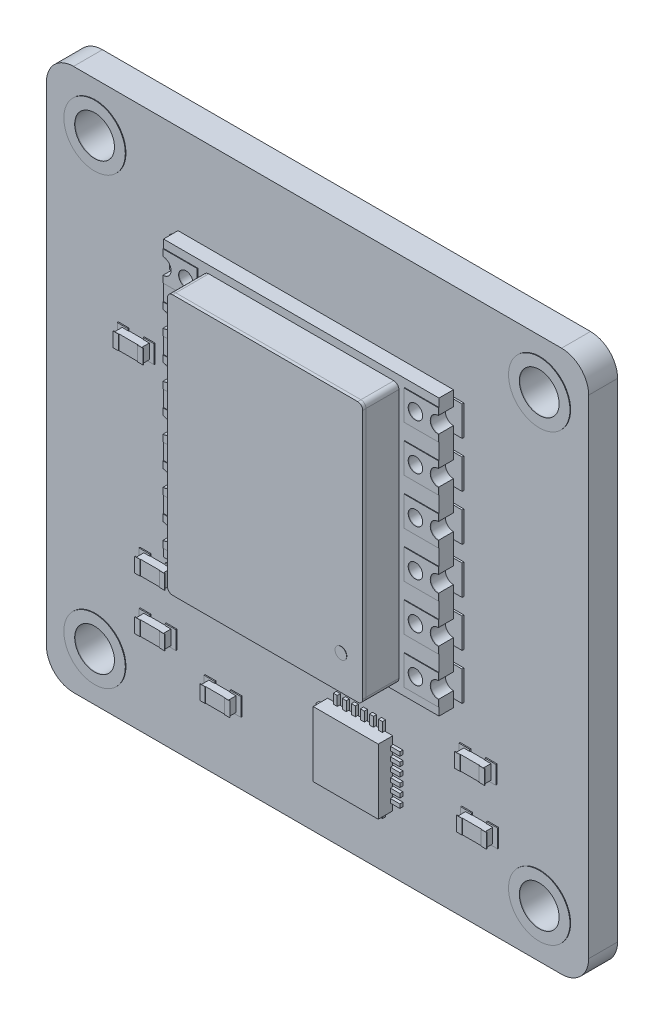
from build123d import *

# Parameters (mm, degrees)
PCB_30X30X1_6_D2_2_24_6_2_R              = 1.1
PCB_30X30X1_6_D2_2_24_6_DEPTH            = 1.6
EXTRUDE_START                            = 1.6
SKETCH_395_R                             = 1.7
SKETCH_395_R_2                           = 1.1
EXTRUDE_419_DEPTH                        = 0.035
EXTRUDE_419_2_DEPTH                      = 0.035
EXTRUDE_419_3_DEPTH                      = 0.035
EXTRUDE_419_4_DEPTH                      = 0.035
SKETCH_12_2_54_W                         = 2.5
SKETCH_12_2_54_H                         = 1.65
EXTRUDE_12_2_54_DEPTH                    = 0.1
EXTRUDE_12_2_54_2_DEPTH                  = 0.1
EXTRUDE_12_2_54_3_DEPTH                  = 0.1
EXTRUDE_12_2_54_4_DEPTH                  = 0.1
EXTRUDE_12_2_54_5_DEPTH                  = 0.1
EXTRUDE_12_2_54_6_DEPTH                  = 0.1
EXTRUDE_12_2_54_7_DEPTH                  = 0.1
EXTRUDE_12_2_54_8_DEPTH                  = 0.1
EXTRUDE_12_2_54_9_DEPTH                  = 0.1
EXTRUDE_12_2_54_10_DEPTH                 = 0.1
EXTRUDE_12_2_54_11_DEPTH                 = 0.1
EXTRUDE_12_2_54_12_DEPTH                 = 0.1
PCB_15_24X15_24X0_8_START                = 1.7
PCB_15_24X15_24X0_8_DEPTH                = 0.8
EXTRUDE_START_2                          = 2.5
EXTRUDE_12_DEPTH                         = 0.035
EXTRUDE_12_2_DEPTH                       = 0.035
EXTRUDE_12_3_DEPTH                       = 0.035
EXTRUDE_12_4_DEPTH                       = 0.035
EXTRUDE_12_5_DEPTH                       = 0.035
EXTRUDE_12_6_DEPTH                       = 0.035
EXTRUDE_12_7_DEPTH                       = 0.035
EXTRUDE_12_8_DEPTH                       = 0.035
EXTRUDE_12_9_DEPTH                       = 0.035
EXTRUDE_12_10_DEPTH                      = 0.035
EXTRUDE_12_11_DEPTH                      = 0.035
EXTRUDE_12_12_DEPTH                      = 0.035
EXTRUDE_0_18_DEPTH                       = 1.82
EXTRUDE_START_3                          = 4.32
EXTRUDE_0_18_2_8_DEPTH                   = 0.18
EXTRUDE_START_4                          = 4.5
SKETCH_1971_R                            = 0.32
EXTRUDE_1980_DEPTH                       = 0.012
EXTRUDE_START_5                          = 1.64
SKETCH_4X4_W                             = 3.6
SKETCH_4X4_H                             = 3.6
EXTRUDE_4X4_DEPTH                        = 0.8
SKETCH_24_W                              = 0.22
SKETCH_24_H                              = 0.55
EXTRUDE_24_DEPTH                         = 0.17
EXTRUDE_24_2_DEPTH                       = 0.17
SKETCH_24_W_2                            = 0.55
SKETCH_24_H_2                            = 0.22
EXTRUDE_24_3_DEPTH                       = 0.17
EXTRUDE_24_4_DEPTH                       = 0.17
EXTRUDE_24_5_DEPTH                       = 0.17
EXTRUDE_24_6_DEPTH                       = 0.17
EXTRUDE_24_7_DEPTH                       = 0.17
EXTRUDE_24_8_DEPTH                       = 0.17
EXTRUDE_24_9_DEPTH                       = 0.17
EXTRUDE_24_10_DEPTH                      = 0.17
EXTRUDE_24_11_DEPTH                      = 0.17
EXTRUDE_24_12_DEPTH                      = 0.17
EXTRUDE_24_13_DEPTH                      = 0.17
EXTRUDE_24_14_DEPTH                      = 0.17
EXTRUDE_24_15_DEPTH                      = 0.17
EXTRUDE_24_16_DEPTH                      = 0.17
EXTRUDE_24_17_DEPTH                      = 0.17
EXTRUDE_24_18_DEPTH                      = 0.17
EXTRUDE_24_19_DEPTH                      = 0.17
EXTRUDE_24_20_DEPTH                      = 0.17
EXTRUDE_24_21_DEPTH                      = 0.17
EXTRUDE_24_22_DEPTH                      = 0.17
EXTRUDE_24_23_DEPTH                      = 0.17
EXTRUDE_24_24_DEPTH                      = 0.17
SKETCH_3138_W                            = 0.6
SKETCH_3138_H                            = 1
EXTRUDE_3373_DEPTH                       = 0.06
EXTRUDE_3373_2_DEPTH                     = 0.06
EXTRUDE_3373_3_DEPTH                     = 0.06
EXTRUDE_3373_4_DEPTH                     = 0.06
EXTRUDE_3373_5_DEPTH                     = 0.06
EXTRUDE_3373_6_DEPTH                     = 0.06
EXTRUDE_3373_7_DEPTH                     = 0.06
EXTRUDE_3373_8_DEPTH                     = 0.06
EXTRUDE_3373_9_DEPTH                     = 0.06
EXTRUDE_3373_10_DEPTH                    = 0.06
EXTRUDE_3373_11_DEPTH                    = 0.06
EXTRUDE_3373_12_DEPTH                    = 0.06
SKETCH_1_W                               = 1.5
SKETCH_1_H                               = 0.8
EXTRUDE_1_DEPTH                          = 0.42
SKETCH_2_W                               = 1.5
SKETCH_2_H                               = 0.8
EXTRUDE_2_DEPTH                          = 0.42
SKETCH_3_W                               = 1.5
SKETCH_3_H                               = 0.8
EXTRUDE_3_DEPTH                          = 0.42
SKETCH_4_W                               = 1.5
SKETCH_4_H                               = 0.8
EXTRUDE_4_DEPTH                          = 0.42
SKETCH_5_W                               = 1.5
SKETCH_5_H                               = 0.8
EXTRUDE_5_DEPTH                          = 0.42
SKETCH_6_W                               = 1.5
SKETCH_6_H                               = 0.8
EXTRUDE_6_DEPTH                          = 0.42
EXTRUDE_START_6                          = 2.06
SKETCH_4104_W                            = 0.3
SKETCH_4104_H                            = 0.8
EXTRUDE_4339_DEPTH                       = 0.025
EXTRUDE_4339_2_DEPTH                     = 0.025
EXTRUDE_4339_3_DEPTH                     = 0.025
EXTRUDE_4339_4_DEPTH                     = 0.025
EXTRUDE_4339_5_DEPTH                     = 0.025
EXTRUDE_4339_6_DEPTH                     = 0.025
EXTRUDE_4339_7_DEPTH                     = 0.025
EXTRUDE_4339_8_DEPTH                     = 0.025
EXTRUDE_4339_9_DEPTH                     = 0.025
EXTRUDE_4339_10_DEPTH                    = 0.025
EXTRUDE_4339_11_DEPTH                    = 0.025
EXTRUDE_4339_12_DEPTH                    = 0.025
CUT_EXTRUDE_12_D0_8_12_7_2_54_DEPTH      = 22.687741791
CUT_EXTRUDE_12_D0_8_12_7_2_54_DEPTH_BACK = 22.687741791
F_12XD0_8_R                              = 0.4


with BuildPart() as part:
    # PCB_30x30x1.6__D2.2__24.6 2 → PCB_30x30x1.6__D2.2__24.6 (new body)
    with BuildSketch(Plane.XY):
        with BuildLine():
            Line((-13.5, -15), (13.5, -15))
            ThreePointArc((13.5, -15), (14.560660172, -14.560660172), (15, -13.5))
            Line((15, -13.5), (15, 13.5))
            ThreePointArc((15, 13.5), (14.560660172, 14.560660172), (13.5, 15))
            Line((13.5, 15), (-13.5, 15))
            ThreePointArc((-13.5, 15), (-14.560660172, 14.560660172), (-15, 13.5))
            Line((-15, 13.5), (-15, -13.5))
            ThreePointArc((-15, -13.5), (-14.560660172, -14.560660172), (-13.5, -15))
        make_face()
        with Locations((-12.3, -12.3)):
            Circle(PCB_30X30X1_6_D2_2_24_6_2_R, mode=Mode.SUBTRACT)
        with Locations((-12.3, 12.3)):
            Circle(PCB_30X30X1_6_D2_2_24_6_2_R, mode=Mode.SUBTRACT)
        with Locations((12.3, -12.3)):
            Circle(PCB_30X30X1_6_D2_2_24_6_2_R, mode=Mode.SUBTRACT)
        with Locations((12.3, 12.3)):
            Circle(PCB_30X30X1_6_D2_2_24_6_2_R, mode=Mode.SUBTRACT)
    extrude(amount=PCB_30X30X1_6_D2_2_24_6_DEPTH)


with BuildPart() as body_2:
    # Sketch 395 → Extrude 419 (new body)
    with BuildSketch(Plane.XY.offset(EXTRUDE_START)):
        with Locations((-12.3, -12.3)):
            Circle(SKETCH_395_R)
        with Locations((-12.3, -12.3)):
            Circle(SKETCH_395_R_2, mode=Mode.SUBTRACT)
    extrude(amount=EXTRUDE_419_DEPTH)


with BuildPart() as body_3:
    # Sketch 395 → Extrude 419 2 (new body)
    with BuildSketch(Plane.XY.offset(EXTRUDE_START)):
        with Locations((-12.3, 12.3)):
            Circle(SKETCH_395_R)
        with Locations((-12.3, 12.3)):
            Circle(SKETCH_395_R_2, mode=Mode.SUBTRACT)
    extrude(amount=EXTRUDE_419_2_DEPTH)


with BuildPart() as body_4:
    # Sketch 395 → Extrude 419 3 (new body)
    with BuildSketch(Plane.XY.offset(EXTRUDE_START)):
        with Locations((12.3, -12.3)):
            Circle(SKETCH_395_R)
        with Locations((12.3, -12.3)):
            Circle(SKETCH_395_R_2, mode=Mode.SUBTRACT)
    extrude(amount=EXTRUDE_419_3_DEPTH)


with BuildPart() as body_5:
    # Sketch 395 → Extrude 419 4 (new body)
    with BuildSketch(Plane.XY.offset(EXTRUDE_START)):
        with Locations((12.3, 12.3)):
            Circle(SKETCH_395_R)
        with Locations((12.3, 12.3)):
            Circle(SKETCH_395_R_2, mode=Mode.SUBTRACT)
    extrude(amount=EXTRUDE_419_4_DEPTH)


with BuildPart() as body_6:
    # 载板12处焊接焊盘_间距2.54_草图 → 载板12处焊接焊盘_间距2.54 (new body)
    with BuildSketch(Plane.XY.offset(EXTRUDE_START)):
        with Locations((-6.85, -3.85)):
            Rectangle(SKETCH_12_2_54_W, SKETCH_12_2_54_H)
    extrude(amount=EXTRUDE_12_2_54_DEPTH)


with BuildPart() as body_7:
    # 载板12处焊接焊盘_间距2.54_草图 → Extrude 12___2.54 2 (new body)
    with BuildSketch(Plane.XY.offset(EXTRUDE_START)):
        with Locations((-6.85, -1.31)):
            Rectangle(SKETCH_12_2_54_W, SKETCH_12_2_54_H)
    extrude(amount=EXTRUDE_12_2_54_2_DEPTH)


with BuildPart() as body_8:
    # 载板12处焊接焊盘_间距2.54_草图 → Extrude 12___2.54 3 (new body)
    with BuildSketch(Plane.XY.offset(EXTRUDE_START)):
        with Locations((-6.85, 1.23)):
            Rectangle(SKETCH_12_2_54_W, SKETCH_12_2_54_H)
    extrude(amount=EXTRUDE_12_2_54_3_DEPTH)


with BuildPart() as body_9:
    # 载板12处焊接焊盘_间距2.54_草图 → Extrude 12___2.54 4 (new body)
    with BuildSketch(Plane.XY.offset(EXTRUDE_START)):
        with Locations((-6.85, 3.77)):
            Rectangle(SKETCH_12_2_54_W, SKETCH_12_2_54_H)
    extrude(amount=EXTRUDE_12_2_54_4_DEPTH)


with BuildPart() as body_10:
    # 载板12处焊接焊盘_间距2.54_草图 → Extrude 12___2.54 5 (new body)
    with BuildSketch(Plane.XY.offset(EXTRUDE_START)):
        with Locations((-6.85, 6.31)):
            Rectangle(SKETCH_12_2_54_W, SKETCH_12_2_54_H)
    extrude(amount=EXTRUDE_12_2_54_5_DEPTH)


with BuildPart() as body_11:
    # 载板12处焊接焊盘_间距2.54_草图 → Extrude 12___2.54 6 (new body)
    with BuildSketch(Plane.XY.offset(EXTRUDE_START)):
        with Locations((-6.85, 8.85)):
            Rectangle(SKETCH_12_2_54_W, SKETCH_12_2_54_H)
    extrude(amount=EXTRUDE_12_2_54_6_DEPTH)


with BuildPart() as body_12:
    # 载板12处焊接焊盘_间距2.54_草图 → Extrude 12___2.54 7 (new body)
    with BuildSketch(Plane.XY.offset(EXTRUDE_START)):
        with Locations((6.85, -3.85)):
            Rectangle(SKETCH_12_2_54_W, SKETCH_12_2_54_H)
    extrude(amount=EXTRUDE_12_2_54_7_DEPTH)


with BuildPart() as body_13:
    # 载板12处焊接焊盘_间距2.54_草图 → Extrude 12___2.54 8 (new body)
    with BuildSketch(Plane.XY.offset(EXTRUDE_START)):
        with Locations((6.85, -1.31)):
            Rectangle(SKETCH_12_2_54_W, SKETCH_12_2_54_H)
    extrude(amount=EXTRUDE_12_2_54_8_DEPTH)


with BuildPart() as body_14:
    # 载板12处焊接焊盘_间距2.54_草图 → Extrude 12___2.54 9 (new body)
    with BuildSketch(Plane.XY.offset(EXTRUDE_START)):
        with Locations((6.85, 1.23)):
            Rectangle(SKETCH_12_2_54_W, SKETCH_12_2_54_H)
    extrude(amount=EXTRUDE_12_2_54_9_DEPTH)


with BuildPart() as body_15:
    # 载板12处焊接焊盘_间距2.54_草图 → Extrude 12___2.54 10 (new body)
    with BuildSketch(Plane.XY.offset(EXTRUDE_START)):
        with Locations((6.85, 3.77)):
            Rectangle(SKETCH_12_2_54_W, SKETCH_12_2_54_H)
    extrude(amount=EXTRUDE_12_2_54_10_DEPTH)


with BuildPart() as body_16:
    # 载板12处焊接焊盘_间距2.54_草图 → Extrude 12___2.54 11 (new body)
    with BuildSketch(Plane.XY.offset(EXTRUDE_START)):
        with Locations((6.85, 6.31)):
            Rectangle(SKETCH_12_2_54_W, SKETCH_12_2_54_H)
    extrude(amount=EXTRUDE_12_2_54_11_DEPTH)


with BuildPart() as body_17:
    # 载板12处焊接焊盘_间距2.54_草图 → Extrude 12___2.54 12 (new body)
    with BuildSketch(Plane.XY.offset(EXTRUDE_START)):
        with Locations((6.85, 8.85)):
            Rectangle(SKETCH_12_2_54_W, SKETCH_12_2_54_H)
    extrude(amount=EXTRUDE_12_2_54_12_DEPTH)


with BuildPart() as body_18:
    # PCB_15.24x15.24x0.8 2 → PCB_15.24x15.24x0.8 (new body)
    with BuildSketch(Plane.XY.offset(PCB_15_24X15_24X0_8_START)):
        with BuildLine():
            Line((-7.62, -5.12), (7.62, -5.12))
            Line((7.62, -5.12), (7.62, -4.3))
            ThreePointArc((7.62, -4.3), (7.17, -3.85), (7.62, -3.4))
            Line((7.62, -3.4), (7.62, -1.76))
            ThreePointArc((7.62, -1.76), (7.17, -1.31), (7.62, -0.86))
            Line((7.62, -0.86), (7.62, 0.78))
            ThreePointArc((7.62, 0.78), (7.17, 1.23), (7.62, 1.68))
            Line((7.62, 1.68), (7.62, 3.32))
            ThreePointArc((7.62, 3.32), (7.17, 3.77), (7.62, 4.22))
            Line((7.62, 4.22), (7.62, 5.86))
            ThreePointArc((7.62, 5.86), (7.17, 6.31), (7.62, 6.76))
            Line((7.62, 6.76), (7.62, 8.4))
            ThreePointArc((7.62, 8.4), (7.17, 8.85), (7.62, 9.3))
            Line((7.62, 9.3), (7.62, 10.12))
            Line((7.62, 10.12), (-7.62, 10.12))
            Line((-7.62, 10.12), (-7.62, 9.3))
            ThreePointArc((-7.62, 9.3), (-7.17, 8.85), (-7.62, 8.4))
            Line((-7.62, 8.4), (-7.62, 6.76))
            ThreePointArc((-7.62, 6.76), (-7.17, 6.31), (-7.62, 5.86))
            Line((-7.62, 5.86), (-7.62, 4.22))
            ThreePointArc((-7.62, 4.22), (-7.17, 3.77), (-7.62, 3.32))
            Line((-7.62, 3.32), (-7.62, 1.68))
            ThreePointArc((-7.62, 1.68), (-7.17, 1.23), (-7.62, 0.78))
            Line((-7.62, 0.78), (-7.62, -0.86))
            ThreePointArc((-7.62, -0.86), (-7.17, -1.31), (-7.62, -1.76))
            Line((-7.62, -1.76), (-7.62, -3.4))
            ThreePointArc((-7.62, -3.4), (-7.17, -3.85), (-7.62, -4.3))
            Line((-7.62, -4.3), (-7.62, -5.12))
        make_face()
    extrude(amount=PCB_15_24X15_24X0_8_DEPTH)


with BuildPart() as body_19:
    # 模块12处半孔镀锡焊盘_草图 → 模块12处半孔镀锡焊盘 (new body)
    with BuildSketch(Plane.XY.offset(EXTRUDE_START_2)):
        with BuildLine():
            Line((-5.72, -4.67), (-5.72, -3.03))
            Line((-5.72, -3.03), (-7.62, -3.03))
            Line((-7.62, -3.03), (-7.62, -3.4))
            ThreePointArc((-7.62, -3.4), (-7.17, -3.85), (-7.62, -4.3))
            Line((-7.62, -4.3), (-7.62, -4.67))
            Line((-7.62, -4.67), (-5.72, -4.67))
        make_face()
    extrude(amount=EXTRUDE_12_DEPTH)


with BuildPart() as body_20:
    # 模块12处半孔镀锡焊盘_草图 → Extrude 12 2 (new body)
    with BuildSketch(Plane.XY.offset(EXTRUDE_START_2)):
        with BuildLine():
            Line((-5.72, -2.13), (-5.72, -0.49))
            Line((-5.72, -0.49), (-7.62, -0.49))
            Line((-7.62, -0.49), (-7.62, -0.86))
            ThreePointArc((-7.62, -0.86), (-7.17, -1.31), (-7.62, -1.76))
            Line((-7.62, -1.76), (-7.62, -2.13))
            Line((-7.62, -2.13), (-5.72, -2.13))
        make_face()
    extrude(amount=EXTRUDE_12_2_DEPTH)


with BuildPart() as body_21:
    # 模块12处半孔镀锡焊盘_草图 → Extrude 12 3 (new body)
    with BuildSketch(Plane.XY.offset(EXTRUDE_START_2)):
        with BuildLine():
            Line((-5.72, 0.41), (-5.72, 2.05))
            Line((-5.72, 2.05), (-7.62, 2.05))
            Line((-7.62, 2.05), (-7.62, 1.68))
            ThreePointArc((-7.62, 1.68), (-7.17, 1.23), (-7.62, 0.78))
            Line((-7.62, 0.78), (-7.62, 0.41))
            Line((-7.62, 0.41), (-5.72, 0.41))
        make_face()
    extrude(amount=EXTRUDE_12_3_DEPTH)


with BuildPart() as body_22:
    # 模块12处半孔镀锡焊盘_草图 → Extrude 12 4 (new body)
    with BuildSketch(Plane.XY.offset(EXTRUDE_START_2)):
        with BuildLine():
            Line((-5.72, 2.95), (-5.72, 4.59))
            Line((-5.72, 4.59), (-7.62, 4.59))
            Line((-7.62, 4.59), (-7.62, 4.22))
            ThreePointArc((-7.62, 4.22), (-7.17, 3.77), (-7.62, 3.32))
            Line((-7.62, 3.32), (-7.62, 2.95))
            Line((-7.62, 2.95), (-5.72, 2.95))
        make_face()
    extrude(amount=EXTRUDE_12_4_DEPTH)


with BuildPart() as body_23:
    # 模块12处半孔镀锡焊盘_草图 → Extrude 12 5 (new body)
    with BuildSketch(Plane.XY.offset(EXTRUDE_START_2)):
        with BuildLine():
            Line((-5.72, 5.49), (-5.72, 7.13))
            Line((-5.72, 7.13), (-7.62, 7.13))
            Line((-7.62, 7.13), (-7.62, 6.76))
            ThreePointArc((-7.62, 6.76), (-7.17, 6.31), (-7.62, 5.86))
            Line((-7.62, 5.86), (-7.62, 5.49))
            Line((-7.62, 5.49), (-5.72, 5.49))
        make_face()
    extrude(amount=EXTRUDE_12_5_DEPTH)


with BuildPart() as body_24:
    # 模块12处半孔镀锡焊盘_草图 → Extrude 12 6 (new body)
    with BuildSketch(Plane.XY.offset(EXTRUDE_START_2)):
        with BuildLine():
            Line((-5.72, 8.03), (-5.72, 9.67))
            Line((-5.72, 9.67), (-7.62, 9.67))
            Line((-7.62, 9.67), (-7.62, 9.3))
            ThreePointArc((-7.62, 9.3), (-7.17, 8.85), (-7.62, 8.4))
            Line((-7.62, 8.4), (-7.62, 8.03))
            Line((-7.62, 8.03), (-5.72, 8.03))
        make_face()
    extrude(amount=EXTRUDE_12_6_DEPTH)


with BuildPart() as body_25:
    # 模块12处半孔镀锡焊盘_草图 → Extrude 12 7 (new body)
    with BuildSketch(Plane.XY.offset(EXTRUDE_START_2)):
        with BuildLine():
            Line((5.72, -4.67), (7.62, -4.67))
            Line((7.62, -4.67), (7.62, -4.3))
            ThreePointArc((7.62, -4.3), (7.17, -3.85), (7.62, -3.4))
            Line((7.62, -3.4), (7.62, -3.03))
            Line((7.62, -3.03), (5.72, -3.03))
            Line((5.72, -3.03), (5.72, -4.67))
        make_face()
    extrude(amount=EXTRUDE_12_7_DEPTH)


with BuildPart() as body_26:
    # 模块12处半孔镀锡焊盘_草图 → Extrude 12 8 (new body)
    with BuildSketch(Plane.XY.offset(EXTRUDE_START_2)):
        with BuildLine():
            Line((5.72, -2.13), (7.62, -2.13))
            Line((7.62, -2.13), (7.62, -1.76))
            ThreePointArc((7.62, -1.76), (7.17, -1.31), (7.62, -0.86))
            Line((7.62, -0.86), (7.62, -0.49))
            Line((7.62, -0.49), (5.72, -0.49))
            Line((5.72, -0.49), (5.72, -2.13))
        make_face()
    extrude(amount=EXTRUDE_12_8_DEPTH)


with BuildPart() as body_27:
    # 模块12处半孔镀锡焊盘_草图 → Extrude 12 9 (new body)
    with BuildSketch(Plane.XY.offset(EXTRUDE_START_2)):
        with BuildLine():
            Line((5.72, 0.41), (7.62, 0.41))
            Line((7.62, 0.41), (7.62, 0.78))
            ThreePointArc((7.62, 0.78), (7.17, 1.23), (7.62, 1.68))
            Line((7.62, 1.68), (7.62, 2.05))
            Line((7.62, 2.05), (5.72, 2.05))
            Line((5.72, 2.05), (5.72, 0.41))
        make_face()
    extrude(amount=EXTRUDE_12_9_DEPTH)


with BuildPart() as body_28:
    # 模块12处半孔镀锡焊盘_草图 → Extrude 12 10 (new body)
    with BuildSketch(Plane.XY.offset(EXTRUDE_START_2)):
        with BuildLine():
            Line((5.72, 2.95), (7.62, 2.95))
            Line((7.62, 2.95), (7.62, 3.32))
            ThreePointArc((7.62, 3.32), (7.17, 3.77), (7.62, 4.22))
            Line((7.62, 4.22), (7.62, 4.59))
            Line((7.62, 4.59), (5.72, 4.59))
            Line((5.72, 4.59), (5.72, 2.95))
        make_face()
    extrude(amount=EXTRUDE_12_10_DEPTH)


with BuildPart() as body_29:
    # 模块12处半孔镀锡焊盘_草图 → Extrude 12 11 (new body)
    with BuildSketch(Plane.XY.offset(EXTRUDE_START_2)):
        with BuildLine():
            Line((5.72, 5.49), (7.62, 5.49))
            Line((7.62, 5.49), (7.62, 5.86))
            ThreePointArc((7.62, 5.86), (7.17, 6.31), (7.62, 6.76))
            Line((7.62, 6.76), (7.62, 7.13))
            Line((7.62, 7.13), (5.72, 7.13))
            Line((5.72, 7.13), (5.72, 5.49))
        make_face()
    extrude(amount=EXTRUDE_12_11_DEPTH)


with BuildPart() as body_30:
    # 模块12处半孔镀锡焊盘_草图 → Extrude 12 12 (new body)
    with BuildSketch(Plane.XY.offset(EXTRUDE_START_2)):
        with BuildLine():
            Line((5.72, 8.03), (7.62, 8.03))
            Line((7.62, 8.03), (7.62, 8.4))
            ThreePointArc((7.62, 8.4), (7.17, 8.85), (7.62, 9.3))
            Line((7.62, 9.3), (7.62, 9.67))
            Line((7.62, 9.67), (5.72, 9.67))
            Line((5.72, 9.67), (5.72, 8.03))
        make_face()
    extrude(amount=EXTRUDE_12_12_DEPTH)


with BuildPart() as body_31:
    # 屏蔽罩侧壁_厚0.18_草图 → 屏蔽罩侧壁_厚0.18 (new body)
    with BuildSketch(Plane.XY.offset(EXTRUDE_START_2)):
        with BuildLine():
            Line((-5.12, -4.7), (5.12, -4.7))
            ThreePointArc((5.12, -4.7), (5.317989899, -4.617989899), (5.4, -4.42))
            Line((5.4, -4.42), (5.4, 9.42))
            ThreePointArc((5.4, 9.42), (5.317989899, 9.617989899), (5.12, 9.7))
            Line((5.12, 9.7), (-5.12, 9.7))
            ThreePointArc((-5.12, 9.7), (-5.317989899, 9.617989899), (-5.4, 9.42))
            Line((-5.4, 9.42), (-5.4, -4.42))
            ThreePointArc((-5.4, -4.42), (-5.317989899, -4.617989899), (-5.12, -4.7))
        make_face()
        with BuildLine():
            Line((-5.12, -4.52), (5.12, -4.52))
            ThreePointArc((5.12, -4.52), (5.190710678, -4.490710678), (5.22, -4.42))
            Line((5.22, -4.42), (5.22, 9.42))
            ThreePointArc((5.22, 9.42), (5.190710678, 9.490710678), (5.12, 9.52))
            Line((5.12, 9.52), (-5.12, 9.52))
            ThreePointArc((-5.12, 9.52), (-5.190710678, 9.490710678), (-5.22, 9.42))
            Line((-5.22, 9.42), (-5.22, -4.42))
            ThreePointArc((-5.22, -4.42), (-5.190710678, -4.490710678), (-5.12, -4.52))
        make_face(mode=Mode.SUBTRACT)
    extrude(amount=EXTRUDE_0_18_DEPTH)


with BuildPart() as body_32:
    # 屏蔽罩顶盖_厚0.18_模块总高2.8_草图 → 屏蔽罩顶盖_厚0.18_模块总高2.8 (new body)
    with BuildSketch(Plane.XY.offset(EXTRUDE_START_3)):
        with BuildLine():
            Line((-5.12, -4.7), (5.12, -4.7))
            ThreePointArc((5.12, -4.7), (5.317989899, -4.617989899), (5.4, -4.42))
            Line((5.4, -4.42), (5.4, 9.42))
            ThreePointArc((5.4, 9.42), (5.317989899, 9.617989899), (5.12, 9.7))
            Line((5.12, 9.7), (-5.12, 9.7))
            ThreePointArc((-5.12, 9.7), (-5.317989899, 9.617989899), (-5.4, 9.42))
            Line((-5.4, 9.42), (-5.4, -4.42))
            ThreePointArc((-5.4, -4.42), (-5.317989899, -4.617989899), (-5.12, -4.7))
        make_face()
    extrude(amount=EXTRUDE_0_18_2_8_DEPTH)


with BuildPart() as body_33:
    # Sketch 1971 → Extrude 1980 (new body)
    with BuildSketch(Plane.XY.offset(EXTRUDE_START_4)):
        with Locations((4.2, -2.8)):
            Circle(SKETCH_1971_R)
    extrude(amount=EXTRUDE_1980_DEPTH)


with BuildPart() as body_34:
    # 载板控制芯片_4x4_草图 → 载板控制芯片_4x4 (new body)
    with BuildSketch(Plane.XY.offset(EXTRUDE_START_5)):
        with Locations((2.4, -10)):
            Rectangle(SKETCH_4X4_W, SKETCH_4X4_H)
    extrude(amount=EXTRUDE_4X4_DEPTH)


with BuildPart() as body_35:
    # 载板控制芯片24引脚_草图 → 载板控制芯片24引脚 (new body)
    with BuildSketch(Plane.XY.offset(EXTRUDE_START)):
        with Locations((1.15, -12.05)):
            Rectangle(SKETCH_24_W, SKETCH_24_H)
    extrude(amount=EXTRUDE_24_DEPTH)


with BuildPart() as body_36:
    # 载板控制芯片24引脚_草图 → Extrude 24 2 (new body)
    with BuildSketch(Plane.XY.offset(EXTRUDE_START)):
        with Locations((1.15, -7.95)):
            Rectangle(SKETCH_24_W, SKETCH_24_H)
    extrude(amount=EXTRUDE_24_2_DEPTH)


with BuildPart() as body_37:
    # 载板控制芯片24引脚_草图 → Extrude 24 3 (new body)
    with BuildSketch(Plane.XY.offset(EXTRUDE_START)):
        with Locations((0.35, -11.25)):
            Rectangle(SKETCH_24_W_2, SKETCH_24_H_2)
    extrude(amount=EXTRUDE_24_3_DEPTH)


with BuildPart() as body_38:
    # 载板控制芯片24引脚_草图 → Extrude 24 4 (new body)
    with BuildSketch(Plane.XY.offset(EXTRUDE_START)):
        with Locations((4.45, -11.25)):
            Rectangle(SKETCH_24_W_2, SKETCH_24_H_2)
    extrude(amount=EXTRUDE_24_4_DEPTH)


with BuildPart() as body_39:
    # 载板控制芯片24引脚_草图 → Extrude 24 5 (new body)
    with BuildSketch(Plane.XY.offset(EXTRUDE_START)):
        with Locations((1.65, -12.05)):
            Rectangle(SKETCH_24_W, SKETCH_24_H)
    extrude(amount=EXTRUDE_24_5_DEPTH)


with BuildPart() as body_40:
    # 载板控制芯片24引脚_草图 → Extrude 24 6 (new body)
    with BuildSketch(Plane.XY.offset(EXTRUDE_START)):
        with Locations((1.65, -7.95)):
            Rectangle(SKETCH_24_W, SKETCH_24_H)
    extrude(amount=EXTRUDE_24_6_DEPTH)


with BuildPart() as body_41:
    # 载板控制芯片24引脚_草图 → Extrude 24 7 (new body)
    with BuildSketch(Plane.XY.offset(EXTRUDE_START)):
        with Locations((0.35, -10.75)):
            Rectangle(SKETCH_24_W_2, SKETCH_24_H_2)
    extrude(amount=EXTRUDE_24_7_DEPTH)


with BuildPart() as body_42:
    # 载板控制芯片24引脚_草图 → Extrude 24 8 (new body)
    with BuildSketch(Plane.XY.offset(EXTRUDE_START)):
        with Locations((4.45, -10.75)):
            Rectangle(SKETCH_24_W_2, SKETCH_24_H_2)
    extrude(amount=EXTRUDE_24_8_DEPTH)


with BuildPart() as body_43:
    # 载板控制芯片24引脚_草图 → Extrude 24 9 (new body)
    with BuildSketch(Plane.XY.offset(EXTRUDE_START)):
        with Locations((2.15, -12.05)):
            Rectangle(SKETCH_24_W, SKETCH_24_H)
    extrude(amount=EXTRUDE_24_9_DEPTH)


with BuildPart() as body_44:
    # 载板控制芯片24引脚_草图 → Extrude 24 10 (new body)
    with BuildSketch(Plane.XY.offset(EXTRUDE_START)):
        with Locations((2.15, -7.95)):
            Rectangle(SKETCH_24_W, SKETCH_24_H)
    extrude(amount=EXTRUDE_24_10_DEPTH)


with BuildPart() as body_45:
    # 载板控制芯片24引脚_草图 → Extrude 24 11 (new body)
    with BuildSketch(Plane.XY.offset(EXTRUDE_START)):
        with Locations((0.35, -10.25)):
            Rectangle(SKETCH_24_W_2, SKETCH_24_H_2)
    extrude(amount=EXTRUDE_24_11_DEPTH)


with BuildPart() as body_46:
    # 载板控制芯片24引脚_草图 → Extrude 24 12 (new body)
    with BuildSketch(Plane.XY.offset(EXTRUDE_START)):
        with Locations((4.45, -10.25)):
            Rectangle(SKETCH_24_W_2, SKETCH_24_H_2)
    extrude(amount=EXTRUDE_24_12_DEPTH)


with BuildPart() as body_47:
    # 载板控制芯片24引脚_草图 → Extrude 24 13 (new body)
    with BuildSketch(Plane.XY.offset(EXTRUDE_START)):
        with Locations((2.65, -12.05)):
            Rectangle(SKETCH_24_W, SKETCH_24_H)
    extrude(amount=EXTRUDE_24_13_DEPTH)


with BuildPart() as body_48:
    # 载板控制芯片24引脚_草图 → Extrude 24 14 (new body)
    with BuildSketch(Plane.XY.offset(EXTRUDE_START)):
        with Locations((2.65, -7.95)):
            Rectangle(SKETCH_24_W, SKETCH_24_H)
    extrude(amount=EXTRUDE_24_14_DEPTH)


with BuildPart() as body_49:
    # 载板控制芯片24引脚_草图 → Extrude 24 15 (new body)
    with BuildSketch(Plane.XY.offset(EXTRUDE_START)):
        with Locations((0.35, -9.75)):
            Rectangle(SKETCH_24_W_2, SKETCH_24_H_2)
    extrude(amount=EXTRUDE_24_15_DEPTH)


with BuildPart() as body_50:
    # 载板控制芯片24引脚_草图 → Extrude 24 16 (new body)
    with BuildSketch(Plane.XY.offset(EXTRUDE_START)):
        with Locations((4.45, -9.75)):
            Rectangle(SKETCH_24_W_2, SKETCH_24_H_2)
    extrude(amount=EXTRUDE_24_16_DEPTH)


with BuildPart() as body_51:
    # 载板控制芯片24引脚_草图 → Extrude 24 17 (new body)
    with BuildSketch(Plane.XY.offset(EXTRUDE_START)):
        with Locations((3.15, -12.05)):
            Rectangle(SKETCH_24_W, SKETCH_24_H)
    extrude(amount=EXTRUDE_24_17_DEPTH)


with BuildPart() as body_52:
    # 载板控制芯片24引脚_草图 → Extrude 24 18 (new body)
    with BuildSketch(Plane.XY.offset(EXTRUDE_START)):
        with Locations((3.15, -7.95)):
            Rectangle(SKETCH_24_W, SKETCH_24_H)
    extrude(amount=EXTRUDE_24_18_DEPTH)


with BuildPart() as body_53:
    # 载板控制芯片24引脚_草图 → Extrude 24 19 (new body)
    with BuildSketch(Plane.XY.offset(EXTRUDE_START)):
        with Locations((0.35, -9.25)):
            Rectangle(SKETCH_24_W_2, SKETCH_24_H_2)
    extrude(amount=EXTRUDE_24_19_DEPTH)


with BuildPart() as body_54:
    # 载板控制芯片24引脚_草图 → Extrude 24 20 (new body)
    with BuildSketch(Plane.XY.offset(EXTRUDE_START)):
        with Locations((4.45, -9.25)):
            Rectangle(SKETCH_24_W_2, SKETCH_24_H_2)
    extrude(amount=EXTRUDE_24_20_DEPTH)


with BuildPart() as body_55:
    # 载板控制芯片24引脚_草图 → Extrude 24 21 (new body)
    with BuildSketch(Plane.XY.offset(EXTRUDE_START)):
        with Locations((3.65, -12.05)):
            Rectangle(SKETCH_24_W, SKETCH_24_H)
    extrude(amount=EXTRUDE_24_21_DEPTH)


with BuildPart() as body_56:
    # 载板控制芯片24引脚_草图 → Extrude 24 22 (new body)
    with BuildSketch(Plane.XY.offset(EXTRUDE_START)):
        with Locations((3.65, -7.95)):
            Rectangle(SKETCH_24_W, SKETCH_24_H)
    extrude(amount=EXTRUDE_24_22_DEPTH)


with BuildPart() as body_57:
    # 载板控制芯片24引脚_草图 → Extrude 24 23 (new body)
    with BuildSketch(Plane.XY.offset(EXTRUDE_START)):
        with Locations((0.35, -8.75)):
            Rectangle(SKETCH_24_W_2, SKETCH_24_H_2)
    extrude(amount=EXTRUDE_24_23_DEPTH)


with BuildPart() as body_58:
    # 载板控制芯片24引脚_草图 → Extrude 24 24 (new body)
    with BuildSketch(Plane.XY.offset(EXTRUDE_START)):
        with Locations((4.45, -8.75)):
            Rectangle(SKETCH_24_W_2, SKETCH_24_H_2)
    extrude(amount=EXTRUDE_24_24_DEPTH)


with BuildPart() as body_59:
    # Sketch 3138 → Extrude 3373 (new body)
    with BuildSketch(Plane.XY.offset(EXTRUDE_START)):
        with Locations((-9.52, -9.6)):
            Rectangle(SKETCH_3138_W, SKETCH_3138_H)
    extrude(amount=EXTRUDE_3373_DEPTH)


with BuildPart() as body_60:
    # Sketch 3138 → Extrude 3373 2 (new body)
    with BuildSketch(Plane.XY.offset(EXTRUDE_START)):
        with Locations((-8.08, -9.6)):
            Rectangle(SKETCH_3138_W, SKETCH_3138_H)
    extrude(amount=EXTRUDE_3373_2_DEPTH)


with BuildPart() as body_61:
    # Sketch 3138 → Extrude 3373 3 (new body)
    with BuildSketch(Plane.XY.offset(EXTRUDE_START)):
        with Locations((-9.52, -6.7)):
            Rectangle(SKETCH_3138_W, SKETCH_3138_H)
    extrude(amount=EXTRUDE_3373_3_DEPTH)


with BuildPart() as body_62:
    # Sketch 3138 → Extrude 3373 4 (new body)
    with BuildSketch(Plane.XY.offset(EXTRUDE_START)):
        with Locations((-8.08, -6.7)):
            Rectangle(SKETCH_3138_W, SKETCH_3138_H)
    extrude(amount=EXTRUDE_3373_4_DEPTH)


with BuildPart() as body_63:
    # Sketch 3138 → Extrude 3373 5 (new body)
    with BuildSketch(Plane.XY.offset(EXTRUDE_START)):
        with Locations((-5.92, -11)):
            Rectangle(SKETCH_3138_W, SKETCH_3138_H)
    extrude(amount=EXTRUDE_3373_5_DEPTH)


with BuildPart() as body_64:
    # Sketch 3138 → Extrude 3373 6 (new body)
    with BuildSketch(Plane.XY.offset(EXTRUDE_START)):
        with Locations((-4.48, -11)):
            Rectangle(SKETCH_3138_W, SKETCH_3138_H)
    extrude(amount=EXTRUDE_3373_6_DEPTH)


with BuildPart() as body_65:
    # Sketch 3138 → Extrude 3373 7 (new body)
    with BuildSketch(Plane.XY.offset(EXTRUDE_START)):
        with Locations((8.18, -7.2)):
            Rectangle(SKETCH_3138_W, SKETCH_3138_H)
    extrude(amount=EXTRUDE_3373_7_DEPTH)


with BuildPart() as body_66:
    # Sketch 3138 → Extrude 3373 8 (new body)
    with BuildSketch(Plane.XY.offset(EXTRUDE_START)):
        with Locations((9.62, -7.2)):
            Rectangle(SKETCH_3138_W, SKETCH_3138_H)
    extrude(amount=EXTRUDE_3373_8_DEPTH)


with BuildPart() as body_67:
    # Sketch 3138 → Extrude 3373 9 (new body)
    with BuildSketch(Plane.XY.offset(EXTRUDE_START)):
        with Locations((8.28, -10.2)):
            Rectangle(SKETCH_3138_W, SKETCH_3138_H)
    extrude(amount=EXTRUDE_3373_9_DEPTH)


with BuildPart() as body_68:
    # Sketch 3138 → Extrude 3373 10 (new body)
    with BuildSketch(Plane.XY.offset(EXTRUDE_START)):
        with Locations((9.72, -10.2)):
            Rectangle(SKETCH_3138_W, SKETCH_3138_H)
    extrude(amount=EXTRUDE_3373_10_DEPTH)


with BuildPart() as body_69:
    # Sketch 3138 → Extrude 3373 11 (new body)
    with BuildSketch(Plane.XY.offset(EXTRUDE_START)):
        with Locations((-10.72, 3.5)):
            Rectangle(SKETCH_3138_W, SKETCH_3138_H)
    extrude(amount=EXTRUDE_3373_11_DEPTH)


with BuildPart() as body_70:
    # Sketch 3138 → Extrude 3373 12 (new body)
    with BuildSketch(Plane.XY.offset(EXTRUDE_START)):
        with Locations((-9.28, 3.5)):
            Rectangle(SKETCH_3138_W, SKETCH_3138_H)
    extrude(amount=EXTRUDE_3373_12_DEPTH)


with BuildPart() as body_71:
    # 贴片元件_1_草图 → 贴片元件_1 (new body)
    with BuildSketch(Plane.XY.offset(EXTRUDE_START_5)):
        with Locations((-8.8, -9.6)):
            Rectangle(SKETCH_1_W, SKETCH_1_H)
    extrude(amount=EXTRUDE_1_DEPTH)


with BuildPart() as body_72:
    # 贴片元件_2_草图 → 贴片元件_2 (new body)
    with BuildSketch(Plane.XY.offset(EXTRUDE_START_5)):
        with Locations((-8.8, -6.7)):
            Rectangle(SKETCH_2_W, SKETCH_2_H)
    extrude(amount=EXTRUDE_2_DEPTH)


with BuildPart() as body_73:
    # 贴片元件_3_草图 → 贴片元件_3 (new body)
    with BuildSketch(Plane.XY.offset(EXTRUDE_START_5)):
        with Locations((-5.2, -11)):
            Rectangle(SKETCH_3_W, SKETCH_3_H)
    extrude(amount=EXTRUDE_3_DEPTH)


with BuildPart() as body_74:
    # 贴片元件_4_草图 → 贴片元件_4 (new body)
    with BuildSketch(Plane.XY.offset(EXTRUDE_START_5)):
        with Locations((8.9, -7.2)):
            Rectangle(SKETCH_4_W, SKETCH_4_H)
    extrude(amount=EXTRUDE_4_DEPTH)


with BuildPart() as body_75:
    # 贴片元件_5_草图 → 贴片元件_5 (new body)
    with BuildSketch(Plane.XY.offset(EXTRUDE_START_5)):
        with Locations((9, -10.2)):
            Rectangle(SKETCH_5_W, SKETCH_5_H)
    extrude(amount=EXTRUDE_5_DEPTH)


with BuildPart() as body_76:
    # 贴片元件_6_草图 → 贴片元件_6 (new body)
    with BuildSketch(Plane.XY.offset(EXTRUDE_START_5)):
        with Locations((-10, 3.5)):
            Rectangle(SKETCH_6_W, SKETCH_6_H)
    extrude(amount=EXTRUDE_6_DEPTH)


with BuildPart() as body_77:
    # Sketch 4104 → Extrude 4339 (new body)
    with BuildSketch(Plane.XY.offset(EXTRUDE_START_6)):
        with Locations((-9.48, -9.6)):
            Rectangle(SKETCH_4104_W, SKETCH_4104_H)
    extrude(amount=EXTRUDE_4339_DEPTH)


with BuildPart() as body_78:
    # Sketch 4104 → Extrude 4339 2 (new body)
    with BuildSketch(Plane.XY.offset(EXTRUDE_START_6)):
        with Locations((-8.12, -9.6)):
            Rectangle(SKETCH_4104_W, SKETCH_4104_H)
    extrude(amount=EXTRUDE_4339_2_DEPTH)


with BuildPart() as body_79:
    # Sketch 4104 → Extrude 4339 3 (new body)
    with BuildSketch(Plane.XY.offset(EXTRUDE_START_6)):
        with Locations((-9.48, -6.7)):
            Rectangle(SKETCH_4104_W, SKETCH_4104_H)
    extrude(amount=EXTRUDE_4339_3_DEPTH)


with BuildPart() as body_80:
    # Sketch 4104 → Extrude 4339 4 (new body)
    with BuildSketch(Plane.XY.offset(EXTRUDE_START_6)):
        with Locations((-8.12, -6.7)):
            Rectangle(SKETCH_4104_W, SKETCH_4104_H)
    extrude(amount=EXTRUDE_4339_4_DEPTH)


with BuildPart() as body_81:
    # Sketch 4104 → Extrude 4339 5 (new body)
    with BuildSketch(Plane.XY.offset(EXTRUDE_START_6)):
        with Locations((-5.88, -11)):
            Rectangle(SKETCH_4104_W, SKETCH_4104_H)
    extrude(amount=EXTRUDE_4339_5_DEPTH)


with BuildPart() as body_82:
    # Sketch 4104 → Extrude 4339 6 (new body)
    with BuildSketch(Plane.XY.offset(EXTRUDE_START_6)):
        with Locations((-4.52, -11)):
            Rectangle(SKETCH_4104_W, SKETCH_4104_H)
    extrude(amount=EXTRUDE_4339_6_DEPTH)


with BuildPart() as body_83:
    # Sketch 4104 → Extrude 4339 7 (new body)
    with BuildSketch(Plane.XY.offset(EXTRUDE_START_6)):
        with Locations((8.22, -7.2)):
            Rectangle(SKETCH_4104_W, SKETCH_4104_H)
    extrude(amount=EXTRUDE_4339_7_DEPTH)


with BuildPart() as body_84:
    # Sketch 4104 → Extrude 4339 8 (new body)
    with BuildSketch(Plane.XY.offset(EXTRUDE_START_6)):
        with Locations((9.58, -7.2)):
            Rectangle(SKETCH_4104_W, SKETCH_4104_H)
    extrude(amount=EXTRUDE_4339_8_DEPTH)


with BuildPart() as body_85:
    # Sketch 4104 → Extrude 4339 9 (new body)
    with BuildSketch(Plane.XY.offset(EXTRUDE_START_6)):
        with Locations((8.32, -10.2)):
            Rectangle(SKETCH_4104_W, SKETCH_4104_H)
    extrude(amount=EXTRUDE_4339_9_DEPTH)


with BuildPart() as body_86:
    # Sketch 4104 → Extrude 4339 10 (new body)
    with BuildSketch(Plane.XY.offset(EXTRUDE_START_6)):
        with Locations((9.68, -10.2)):
            Rectangle(SKETCH_4104_W, SKETCH_4104_H)
    extrude(amount=EXTRUDE_4339_10_DEPTH)


with BuildPart() as body_87:
    # Sketch 4104 → Extrude 4339 11 (new body)
    with BuildSketch(Plane.XY.offset(EXTRUDE_START_6)):
        with Locations((-10.68, 3.5)):
            Rectangle(SKETCH_4104_W, SKETCH_4104_H)
    extrude(amount=EXTRUDE_4339_11_DEPTH)


with BuildPart() as body_88:
    # Sketch 4104 → Extrude 4339 12 (new body)
    with BuildSketch(Plane.XY.offset(EXTRUDE_START_6)):
        with Locations((-9.32, 3.5)):
            Rectangle(SKETCH_4104_W, SKETCH_4104_H)
    extrude(amount=EXTRUDE_4339_12_DEPTH)


with BuildPart() as cut_extrude_12_d0_8_12_7_2_54_tool:
    # 完整引脚圆孔_12xD0.8_草图 → 12个完整引脚通孔_D0.8_排距12.7_间距2.54 (new, two sides: drawn at the far end of the back side and taken through both)
    with BuildSketch(Plane.XY.offset(-CUT_EXTRUDE_12_D0_8_12_7_2_54_DEPTH_BACK)):
        with Locations(Location((-6.35, -3.85, 0), (0, 0, 180))):
            Circle(F_12XD0_8_R)
        with Locations(Location((-6.35, -1.31, 0), (0, 0, 180))):
            Circle(F_12XD0_8_R)
        with Locations(Location((-6.35, 1.23, 0), (0, 0, 180))):
            Circle(F_12XD0_8_R)
        with Locations(Location((-6.35, 3.77, 0), (0, 0, 180))):
            Circle(F_12XD0_8_R)
        with Locations(Location((-6.35, 6.31, 0), (0, 0, 180))):
            Circle(F_12XD0_8_R)
        with Locations(Location((-6.35, 8.85, 0), (0, 0, 180))):
            Circle(F_12XD0_8_R)
        with Locations(Location((6.35, -3.85, 0), (0, 0, 180))):
            Circle(F_12XD0_8_R)
        with Locations(Location((6.35, -1.31, 0), (0, 0, 180))):
            Circle(F_12XD0_8_R)
        with Locations(Location((6.35, 1.23, 0), (0, 0, 180))):
            Circle(F_12XD0_8_R)
        with Locations(Location((6.35, 3.77, 0), (0, 0, 180))):
            Circle(F_12XD0_8_R)
        with Locations(Location((6.35, 6.31, 0), (0, 0, 180))):
            Circle(F_12XD0_8_R)
        with Locations(Location((6.35, 8.85, 0), (0, 0, 180))):
            Circle(F_12XD0_8_R)
    extrude(amount=CUT_EXTRUDE_12_D0_8_12_7_2_54_DEPTH + CUT_EXTRUDE_12_D0_8_12_7_2_54_DEPTH_BACK)


with BuildPart() as part_1:
    add(part.part)

    # 12个完整引脚通孔_D0.8_排距12.7_间距2.54: cut by cut_extrude_12_d0_8_12_7_2_54_tool
    add(cut_extrude_12_d0_8_12_7_2_54_tool.part, mode=Mode.SUBTRACT)


with BuildPart() as body_6_1:
    add(body_6.part)

    # 12个完整引脚通孔_D0.8_排距12.7_间距2.54: cut by cut_extrude_12_d0_8_12_7_2_54_tool
    add(cut_extrude_12_d0_8_12_7_2_54_tool.part, mode=Mode.SUBTRACT)


with BuildPart() as body_7_1:
    add(body_7.part)

    # 12个完整引脚通孔_D0.8_排距12.7_间距2.54: cut by cut_extrude_12_d0_8_12_7_2_54_tool
    add(cut_extrude_12_d0_8_12_7_2_54_tool.part, mode=Mode.SUBTRACT)


with BuildPart() as body_8_1:
    add(body_8.part)

    # 12个完整引脚通孔_D0.8_排距12.7_间距2.54: cut by cut_extrude_12_d0_8_12_7_2_54_tool
    add(cut_extrude_12_d0_8_12_7_2_54_tool.part, mode=Mode.SUBTRACT)


with BuildPart() as body_9_1:
    add(body_9.part)

    # 12个完整引脚通孔_D0.8_排距12.7_间距2.54: cut by cut_extrude_12_d0_8_12_7_2_54_tool
    add(cut_extrude_12_d0_8_12_7_2_54_tool.part, mode=Mode.SUBTRACT)


with BuildPart() as body_10_1:
    add(body_10.part)

    # 12个完整引脚通孔_D0.8_排距12.7_间距2.54: cut by cut_extrude_12_d0_8_12_7_2_54_tool
    add(cut_extrude_12_d0_8_12_7_2_54_tool.part, mode=Mode.SUBTRACT)


with BuildPart() as body_11_1:
    add(body_11.part)

    # 12个完整引脚通孔_D0.8_排距12.7_间距2.54: cut by cut_extrude_12_d0_8_12_7_2_54_tool
    add(cut_extrude_12_d0_8_12_7_2_54_tool.part, mode=Mode.SUBTRACT)


with BuildPart() as body_12_1:
    add(body_12.part)

    # 12个完整引脚通孔_D0.8_排距12.7_间距2.54: cut by cut_extrude_12_d0_8_12_7_2_54_tool
    add(cut_extrude_12_d0_8_12_7_2_54_tool.part, mode=Mode.SUBTRACT)


with BuildPart() as body_13_1:
    add(body_13.part)

    # 12个完整引脚通孔_D0.8_排距12.7_间距2.54: cut by cut_extrude_12_d0_8_12_7_2_54_tool
    add(cut_extrude_12_d0_8_12_7_2_54_tool.part, mode=Mode.SUBTRACT)


with BuildPart() as body_14_1:
    add(body_14.part)

    # 12个完整引脚通孔_D0.8_排距12.7_间距2.54: cut by cut_extrude_12_d0_8_12_7_2_54_tool
    add(cut_extrude_12_d0_8_12_7_2_54_tool.part, mode=Mode.SUBTRACT)


with BuildPart() as body_15_1:
    add(body_15.part)

    # 12个完整引脚通孔_D0.8_排距12.7_间距2.54: cut by cut_extrude_12_d0_8_12_7_2_54_tool
    add(cut_extrude_12_d0_8_12_7_2_54_tool.part, mode=Mode.SUBTRACT)


with BuildPart() as body_16_1:
    add(body_16.part)

    # 12个完整引脚通孔_D0.8_排距12.7_间距2.54: cut by cut_extrude_12_d0_8_12_7_2_54_tool
    add(cut_extrude_12_d0_8_12_7_2_54_tool.part, mode=Mode.SUBTRACT)


with BuildPart() as body_17_1:
    add(body_17.part)

    # 12个完整引脚通孔_D0.8_排距12.7_间距2.54: cut by cut_extrude_12_d0_8_12_7_2_54_tool
    add(cut_extrude_12_d0_8_12_7_2_54_tool.part, mode=Mode.SUBTRACT)


with BuildPart() as body_18_1:
    add(body_18.part)

    # 12个完整引脚通孔_D0.8_排距12.7_间距2.54: cut by cut_extrude_12_d0_8_12_7_2_54_tool
    add(cut_extrude_12_d0_8_12_7_2_54_tool.part, mode=Mode.SUBTRACT)


with BuildPart() as body_19_1:
    add(body_19.part)

    # 12个完整引脚通孔_D0.8_排距12.7_间距2.54: cut by cut_extrude_12_d0_8_12_7_2_54_tool
    add(cut_extrude_12_d0_8_12_7_2_54_tool.part, mode=Mode.SUBTRACT)


with BuildPart() as body_20_1:
    add(body_20.part)

    # 12个完整引脚通孔_D0.8_排距12.7_间距2.54: cut by cut_extrude_12_d0_8_12_7_2_54_tool
    add(cut_extrude_12_d0_8_12_7_2_54_tool.part, mode=Mode.SUBTRACT)


with BuildPart() as body_21_1:
    add(body_21.part)

    # 12个完整引脚通孔_D0.8_排距12.7_间距2.54: cut by cut_extrude_12_d0_8_12_7_2_54_tool
    add(cut_extrude_12_d0_8_12_7_2_54_tool.part, mode=Mode.SUBTRACT)


with BuildPart() as body_22_1:
    add(body_22.part)

    # 12个完整引脚通孔_D0.8_排距12.7_间距2.54: cut by cut_extrude_12_d0_8_12_7_2_54_tool
    add(cut_extrude_12_d0_8_12_7_2_54_tool.part, mode=Mode.SUBTRACT)


with BuildPart() as body_23_1:
    add(body_23.part)

    # 12个完整引脚通孔_D0.8_排距12.7_间距2.54: cut by cut_extrude_12_d0_8_12_7_2_54_tool
    add(cut_extrude_12_d0_8_12_7_2_54_tool.part, mode=Mode.SUBTRACT)


with BuildPart() as body_24_1:
    add(body_24.part)

    # 12个完整引脚通孔_D0.8_排距12.7_间距2.54: cut by cut_extrude_12_d0_8_12_7_2_54_tool
    add(cut_extrude_12_d0_8_12_7_2_54_tool.part, mode=Mode.SUBTRACT)


with BuildPart() as body_25_1:
    add(body_25.part)

    # 12个完整引脚通孔_D0.8_排距12.7_间距2.54: cut by cut_extrude_12_d0_8_12_7_2_54_tool
    add(cut_extrude_12_d0_8_12_7_2_54_tool.part, mode=Mode.SUBTRACT)


with BuildPart() as body_26_1:
    add(body_26.part)

    # 12个完整引脚通孔_D0.8_排距12.7_间距2.54: cut by cut_extrude_12_d0_8_12_7_2_54_tool
    add(cut_extrude_12_d0_8_12_7_2_54_tool.part, mode=Mode.SUBTRACT)


with BuildPart() as body_27_1:
    add(body_27.part)

    # 12个完整引脚通孔_D0.8_排距12.7_间距2.54: cut by cut_extrude_12_d0_8_12_7_2_54_tool
    add(cut_extrude_12_d0_8_12_7_2_54_tool.part, mode=Mode.SUBTRACT)


with BuildPart() as body_28_1:
    add(body_28.part)

    # 12个完整引脚通孔_D0.8_排距12.7_间距2.54: cut by cut_extrude_12_d0_8_12_7_2_54_tool
    add(cut_extrude_12_d0_8_12_7_2_54_tool.part, mode=Mode.SUBTRACT)


with BuildPart() as body_29_1:
    add(body_29.part)

    # 12个完整引脚通孔_D0.8_排距12.7_间距2.54: cut by cut_extrude_12_d0_8_12_7_2_54_tool
    add(cut_extrude_12_d0_8_12_7_2_54_tool.part, mode=Mode.SUBTRACT)


with BuildPart() as body_30_1:
    add(body_30.part)

    # 12个完整引脚通孔_D0.8_排距12.7_间距2.54: cut by cut_extrude_12_d0_8_12_7_2_54_tool
    add(cut_extrude_12_d0_8_12_7_2_54_tool.part, mode=Mode.SUBTRACT)


solid = Compound([body_2.part, body_3.part, body_4.part, body_5.part, body_31.part, body_32.part, body_33.part, body_34.part, body_35.part, body_36.part, body_37.part, body_38.part, body_39.part, body_40.part, body_41.part, body_42.part, body_43.part, body_44.part, body_45.part, body_46.part, body_47.part, body_48.part, body_49.part, body_50.part, body_51.part, body_52.part, body_53.part, body_54.part, body_55.part, body_56.part, body_57.part, body_58.part, body_59.part, body_60.part, body_61.part, body_62.part, body_63.part, body_64.part, body_65.part, body_66.part, body_67.part, body_68.part, body_69.part, body_70.part, body_71.part, body_72.part, body_73.part, body_74.part, body_75.part, body_76.part, body_77.part, body_78.part, body_79.part, body_80.part, body_81.part, body_82.part, body_83.part, body_84.part, body_85.part, body_86.part, body_87.part, body_88.part, part_1.part, body_6_1.part, body_7_1.part, body_8_1.part, body_9_1.part, body_10_1.part, body_11_1.part, body_12_1.part, body_13_1.part, body_14_1.part, body_15_1.part, body_16_1.part, body_17_1.part, body_18_1.part, body_19_1.part, body_20_1.part, body_21_1.part, body_22_1.part, body_23_1.part, body_24_1.part, body_25_1.part, body_26_1.part, body_27_1.part, body_28_1.part, body_29_1.part, body_30_1.part])
